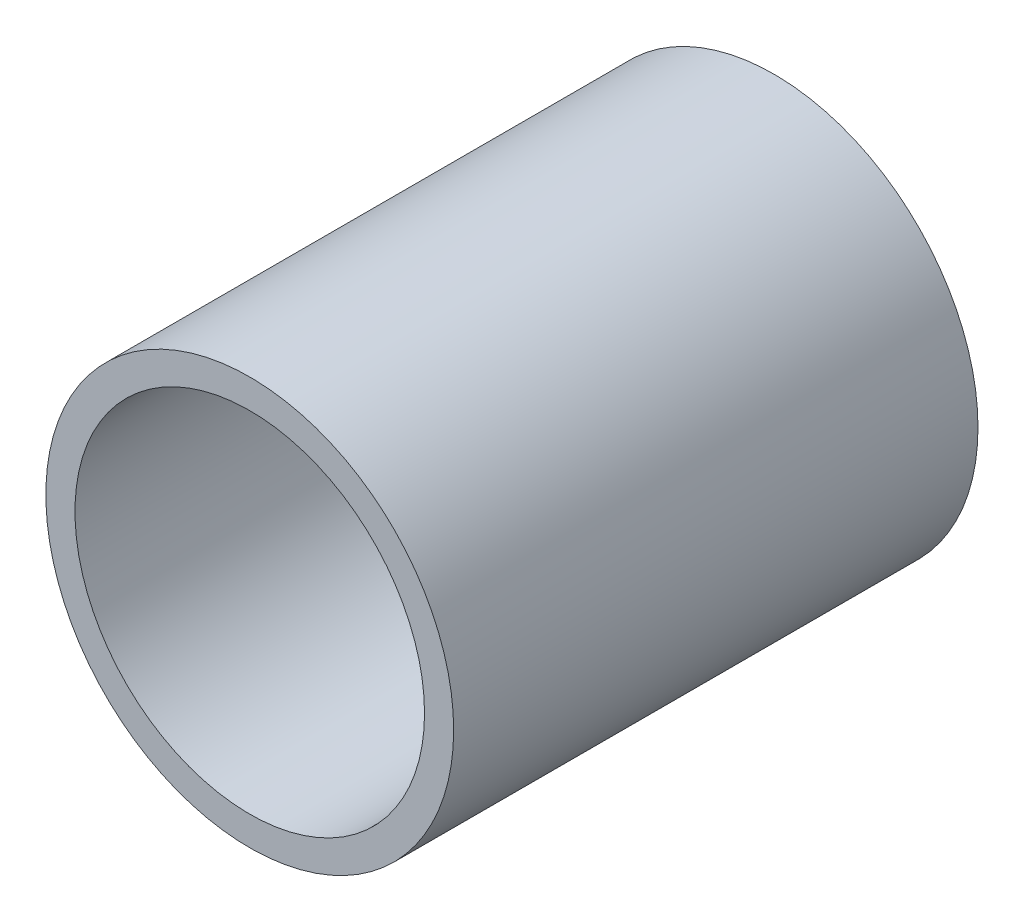
from build123d import *

# Parameters (mm, degrees)
SKETCH1_R           = 44.45
SKETCH1_R_2         = 38.1
EXTRUDE_THIN1_DEPTH = 114.3


with BuildPart() as part:
    # Sketch1 → Extrude-Thin1 (new body)
    with BuildSketch(Plane.XY):
        Circle(SKETCH1_R)
        Circle(SKETCH1_R_2, mode=Mode.SUBTRACT)
    extrude(amount=EXTRUDE_THIN1_DEPTH)


solid = part.part
